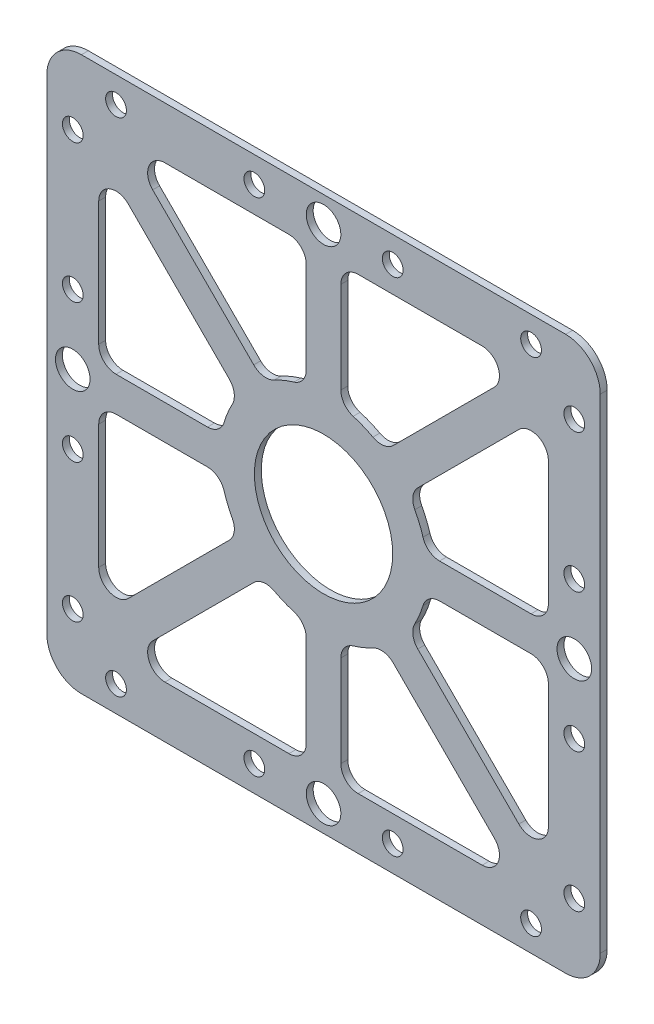
from build123d import *

# Parameters (mm, degrees)
SALIENTE_EXTRUIR1_DEPTH = 1
CROQUIS2_R              = 10
CORTAR_EXTRUIR1_DEPTH   = 57.577380639
CROQUIS3_R              = 1.5
CROQUIS3_R_2            = 2.5
CORTAR_EXTRUIR2_DEPTH   = 57.577380639
MATRIZC1_COUNT          = 4


with BuildPart() as part:
    # Croquis1 → Saliente-Extruir1 (new body)
    with BuildSketch(Plane.XY):
        with BuildLine():
            Line((-35, -40), (35, -40))
            ThreePointArc((35, -40), (38.535533906, -38.535533906), (40, -35))
            Line((40, -35), (40, 35))
            ThreePointArc((40, 35), (38.535533906, 38.535533906), (35, 40))
            Line((35, 40), (-35, 40))
            ThreePointArc((-35, 40), (-38.535533906, 38.535533906), (-40, 35))
            Line((-40, 35), (-40, -35))
            ThreePointArc((-40, -35), (-38.535533906, -38.535533906), (-35, -40))
        make_face()
    extrude(amount=SALIENTE_EXTRUIR1_DEPTH)

    # Croquis2 → Cortar-Extruir1 (cut, through all)
    with BuildSketch(Plane.XY.offset(1)):
        Circle(CROQUIS2_R)
        with BuildLine():
            Line((2.5, 16.770509831), (2.5, 30))
            ThreePointArc((2.5, 30), (3.232233047, 31.767766953), (5, 32.5))
            Line((5, 32.5), (22.928932188, 32.5))
            ThreePointArc((22.928932188, 32.5), (25.238631019, 30.956708581), (24.696699141, 28.232233047))
            Line((24.696699141, 28.232233047), (10.090774273, 13.626308179))
            ThreePointArc((10.090774273, 13.626308179), (8.683931275, 12.920265539), (7.134006274, 13.194921541))
            ThreePointArc((7.134006274, 13.194921541), (5.740251485, 13.858192988), (4.285714286, 14.374722712))
            ThreePointArc((4.285714286, 14.374722712), (2.995540686, 15.27647407), (2.5, 16.770509831))
        make_face()
        with BuildLine():
            Line((-10.090774273, 13.626308179), (-24.696699141, 28.232233047))
            ThreePointArc((-24.696699141, 28.232233047), (-25.238631019, 30.956708581), (-22.928932188, 32.5))
            Line((-22.928932188, 32.5), (-5, 32.5))
            ThreePointArc((-5, 32.5), (-3.232233047, 31.767766953), (-2.5, 30))
            Line((-2.5, 30), (-2.5, 16.770509831))
            ThreePointArc((-2.5, 16.770509831), (-2.995540686, 15.27647407), (-4.285714286, 14.374722712))
            ThreePointArc((-4.285714286, 14.374722712), (-5.740251485, 13.858192988), (-7.134006274, 13.194921541))
            ThreePointArc((-7.134006274, 13.194921541), (-8.683931275, 12.920265539), (-10.090774273, 13.626308179))
        make_face()
        with BuildLine():
            Line((32.5, 5), (32.5, 22.928932188))
            ThreePointArc((32.5, 22.928932188), (30.956708581, 25.238631019), (28.232233047, 24.696699141))
            Line((28.232233047, 24.696699141), (13.626308179, 10.090774273))
            ThreePointArc((13.626308179, 10.090774273), (12.920265539, 8.683931275), (13.194921541, 7.134006274))
            ThreePointArc((13.194921541, 7.134006274), (13.858192988, 5.740251485), (14.374722712, 4.285714286))
            ThreePointArc((14.374722712, 4.285714286), (15.27647407, 2.995540686), (16.770509831, 2.5))
            Line((16.770509831, 2.5), (30, 2.5))
            ThreePointArc((30, 2.5), (31.767766953, 3.232233047), (32.5, 5))
        make_face()
        with BuildLine():
            Line((16.770509831, -2.5), (30, -2.5))
            ThreePointArc((30, -2.5), (31.767766953, -3.232233047), (32.5, -5))
            Line((32.5, -5), (32.5, -22.928932188))
            ThreePointArc((32.5, -22.928932188), (30.956708581, -25.238631019), (28.232233047, -24.696699141))
            Line((28.232233047, -24.696699141), (13.626308179, -10.090774273))
            ThreePointArc((13.626308179, -10.090774273), (12.920265539, -8.683931275), (13.194921541, -7.134006274))
            ThreePointArc((13.194921541, -7.134006274), (13.858192988, -5.740251485), (14.374722712, -4.285714286))
            ThreePointArc((14.374722712, -4.285714286), (15.27647407, -2.995540686), (16.770509831, -2.5))
        make_face()
        with BuildLine():
            Line((5, -32.5), (22.928932188, -32.5))
            ThreePointArc((22.928932188, -32.5), (25.238631019, -30.956708581), (24.696699141, -28.232233047))
            Line((24.696699141, -28.232233047), (10.090774273, -13.626308179))
            ThreePointArc((10.090774273, -13.626308179), (8.683931275, -12.920265539), (7.134006274, -13.194921541))
            ThreePointArc((7.134006274, -13.194921541), (5.740251485, -13.858192988), (4.285714286, -14.374722712))
            ThreePointArc((4.285714286, -14.374722712), (2.995540686, -15.27647407), (2.5, -16.770509831))
            Line((2.5, -16.770509831), (2.5, -30))
            ThreePointArc((2.5, -30), (3.232233047, -31.767766953), (5, -32.5))
        make_face()
        with BuildLine():
            Line((-2.5, -16.770509831), (-2.5, -30))
            ThreePointArc((-2.5, -30), (-3.232233047, -31.767766953), (-5, -32.5))
            Line((-5, -32.5), (-22.928932188, -32.5))
            ThreePointArc((-22.928932188, -32.5), (-25.238631019, -30.956708581), (-24.696699141, -28.232233047))
            Line((-24.696699141, -28.232233047), (-10.090774273, -13.626308179))
            ThreePointArc((-10.090774273, -13.626308179), (-8.683931275, -12.920265539), (-7.134006274, -13.194921541))
            ThreePointArc((-7.134006274, -13.194921541), (-5.740251485, -13.858192988), (-4.285714286, -14.374722712))
            ThreePointArc((-4.285714286, -14.374722712), (-2.995540686, -15.27647407), (-2.5, -16.770509831))
        make_face()
        with BuildLine():
            Line((-32.5, -5), (-32.5, -22.928932188))
            ThreePointArc((-32.5, -22.928932188), (-30.956708581, -25.238631019), (-28.232233047, -24.696699141))
            Line((-28.232233047, -24.696699141), (-13.626308179, -10.090774273))
            ThreePointArc((-13.626308179, -10.090774273), (-12.920265539, -8.683931275), (-13.194921541, -7.134006274))
            ThreePointArc((-13.194921541, -7.134006274), (-13.858192988, -5.740251485), (-14.374722712, -4.285714286))
            ThreePointArc((-14.374722712, -4.285714286), (-15.27647407, -2.995540686), (-16.770509831, -2.5))
            Line((-16.770509831, -2.5), (-30, -2.5))
            ThreePointArc((-30, -2.5), (-31.767766953, -3.232233047), (-32.5, -5))
        make_face()
        with BuildLine():
            Line((-16.770509831, 2.5), (-30, 2.5))
            ThreePointArc((-30, 2.5), (-31.767766953, 3.232233047), (-32.5, 5))
            Line((-32.5, 5), (-32.5, 22.928932188))
            ThreePointArc((-32.5, 22.928932188), (-30.956708581, 25.238631019), (-28.232233047, 24.696699141))
            Line((-28.232233047, 24.696699141), (-13.626308179, 10.090774273))
            ThreePointArc((-13.626308179, 10.090774273), (-12.920265539, 8.683931275), (-13.194921541, 7.134006274))
            ThreePointArc((-13.194921541, 7.134006274), (-13.858192988, 5.740251485), (-14.374722712, 4.285714286))
            ThreePointArc((-14.374722712, 4.285714286), (-15.27647407, 2.995540686), (-16.770509831, 2.5))
        make_face()
    extrude(amount=-CORTAR_EXTRUIR1_DEPTH, mode=Mode.SUBTRACT)

    # Croquis3 → Cortar-Extruir2 (cut, through all)
    with BuildSketch(Plane.XY.offset(1)):
        with Locations((-36.25, 30)):
            Circle(CROQUIS3_R)
        with Locations((-36.25, 10)):
            Circle(CROQUIS3_R)
        with Locations((-36.25, -10)):
            Circle(CROQUIS3_R)
        with Locations((-36.25, -30)):
            Circle(CROQUIS3_R)
        with Locations(Location((36.25, -30, 0), (0, 0, 180))):
            Circle(CROQUIS3_R)
        with Locations(Location((36.25, -10, 0), (0, 0, 180))):
            Circle(CROQUIS3_R)
        with Locations(Location((36.25, 10, 0), (0, 0, 180))):
            Circle(CROQUIS3_R)
        with Locations(Location((36.25, 30, 0), (0, 0, 180))):
            Circle(CROQUIS3_R)
        with Locations((-36.25, 0)):
            Circle(CROQUIS3_R_2)
        with Locations(Location((36.25, 0, 0), (0, 0, 180))):
            Circle(CROQUIS3_R_2)
    cortar_extruir2 = extrude(amount=-CORTAR_EXTRUIR2_DEPTH, mode=Mode.SUBTRACT)

    # MatrizC1: Cortar-Extruir2 ×4 about axis
    matrizc1_axis = Axis((0, 0, 0), (0, 0, 1))
    for i in range(1, MATRIZC1_COUNT):
        add(cortar_extruir2.rotate(matrizc1_axis, i * 360 / MATRIZC1_COUNT), mode=Mode.SUBTRACT)


solid = part.part
